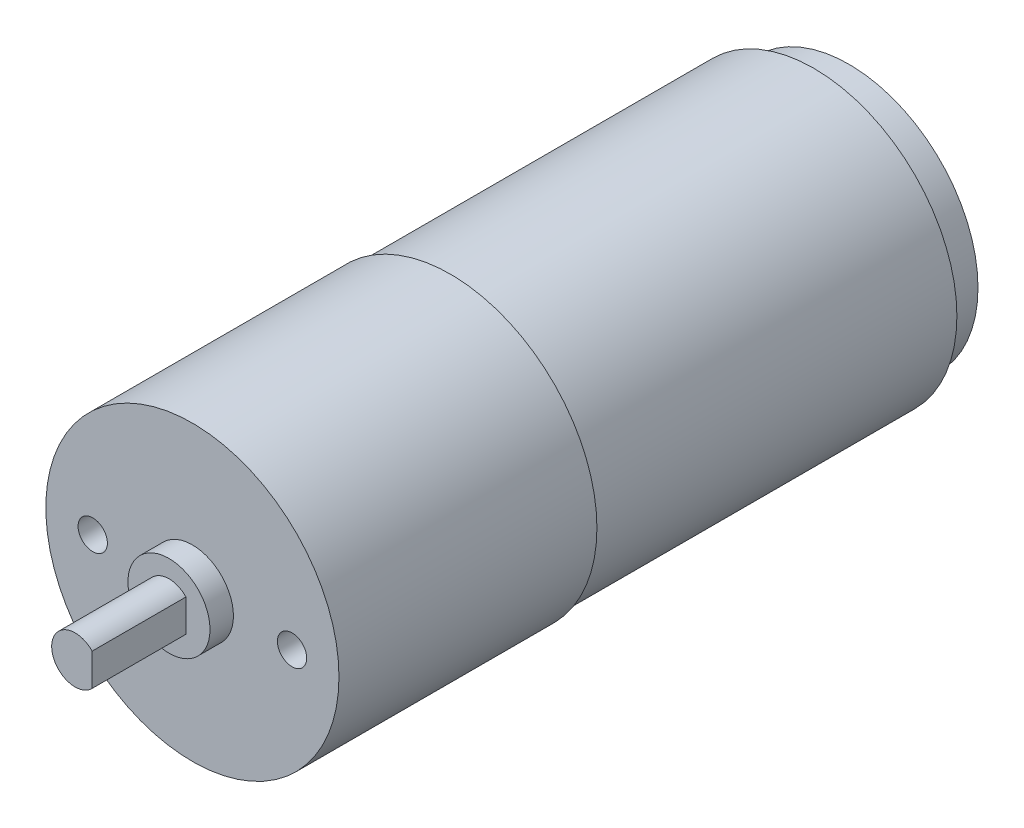
from build123d import *

# Parameters (mm, degrees)
SKETCH1_R           = 12.5
GEARBOX_DEPTH       = 22
SKETCH2_R           = 12.2
CAN_DEPTH           = 31
SKETCH3_R           = 11
END_CAP_DEPTH       = 3
SKETCH4_R           = 3.5
BEARING_BOSS_DEPTH  = 2
SHAFT_4MM_D_DEPTH   = 8
SKETCH6_R           = 1.25
M3_FACE_HOLES_DEPTH = 5


with BuildPart() as part:
    # Sketch1 → Gearbox (new body)
    with BuildSketch(Plane.XY.offset(-22)):
        Circle(SKETCH1_R)
    extrude(amount=GEARBOX_DEPTH)

    # Sketch2 → Can (add)
    with BuildSketch(Plane.XY.offset(-53)):
        Circle(SKETCH2_R)
    extrude(amount=CAN_DEPTH)

    # Sketch3 → End_cap (add)
    with BuildSketch(Plane.XY.offset(-56)):
        Circle(SKETCH3_R)
    extrude(amount=END_CAP_DEPTH)

    # Sketch4 → Bearing_boss (add)
    with BuildSketch(Plane.XY):
        Circle(SKETCH4_R)
    extrude(amount=BEARING_BOSS_DEPTH)

    # Sketch5 → Shaft_4mm_D (add)
    with BuildSketch(Plane.XY.offset(2)):
        with BuildLine():
            Line((1.45, -1.377497731), (1.45, 1.377497731))
            ThreePointArc((1.45, 1.377497731), (-2, 0), (1.45, -1.377497731))
        make_face()
    extrude(amount=SHAFT_4MM_D_DEPTH)

    # Sketch6 → M3_face_holes (cut)
    with BuildSketch(Plane.XY):
        with Locations((-8.5, 0)):
            Circle(SKETCH6_R)
        with Locations((8.5, 0)):
            Circle(SKETCH6_R)
    extrude(amount=-M3_FACE_HOLES_DEPTH, mode=Mode.SUBTRACT)


solid = part.part
